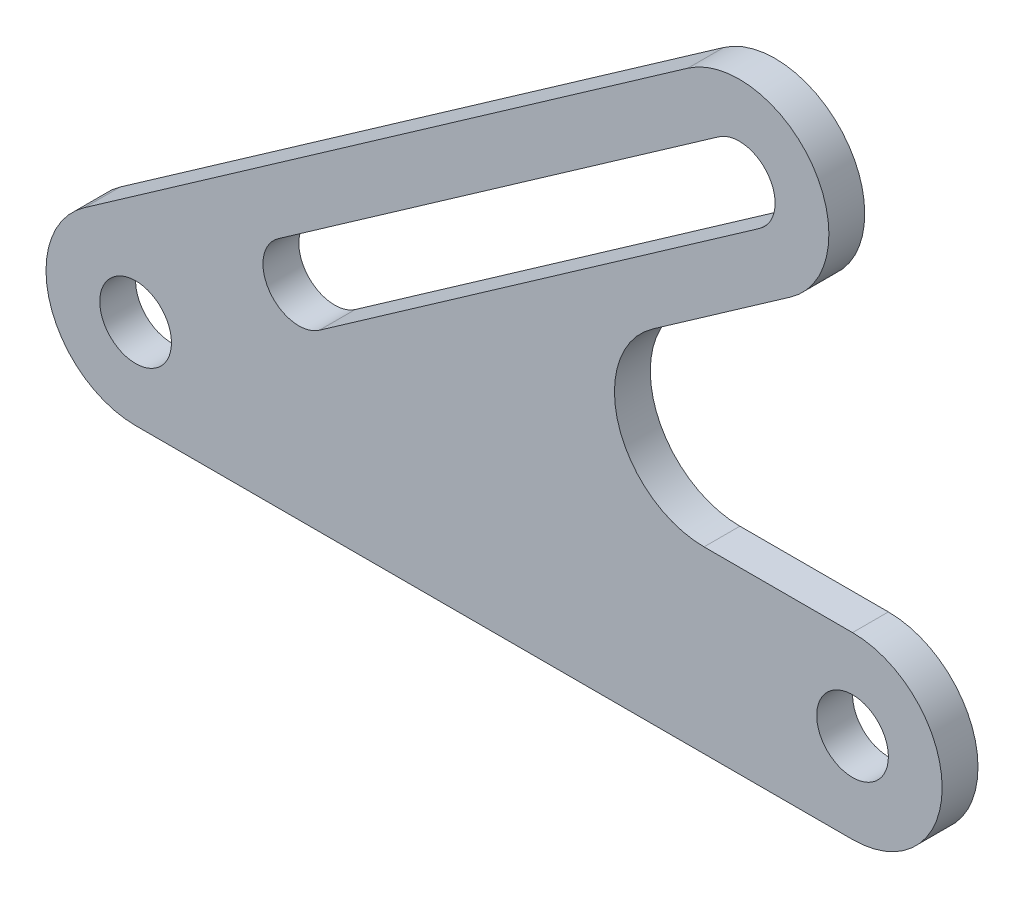
from build123d import *

# Parameters (mm, degrees)
BOSS_EXTRUDE1_DEPTH     = 2
CUT_EXTRUDE1_DEPTH      = 4
CUT_EXTRUDE1_DEPTH_BACK = 107.639946795
SKETCH2_R               = 4
FILLET1_R               = 10


with BuildPart() as part:
    # Sketch1 → Boss-Extrude1 (new, symmetric)
    with BuildSketch(Plane.XY):
        with BuildLine():
            Line((61.625847103, 55.358628577), (-5.735764364, 8.191520443))
            ThreePointArc((-5.735764364, 8.191520443), (-3.007057995, 9.537169507), (0, 10))
            Line((0, 10), (31.715948024, 10))
            Line((31.715948024, 10), (73.09737583, 38.975587692))
            ThreePointArc((73.09737583, 38.975587692), (75.553131909, 52.902872498), (61.625847103, 55.358628577))
        make_face()
        with BuildLine():
            ThreePointArc((0, 10), (-3.007057995, 9.537169507), (-5.735764364, 8.191520443))
            ThreePointArc((-5.735764364, 8.191520443), (-9.537169507, -3.007057995), (0, -10))
            ThreePointArc((0, -10), (3.007057995, -9.537169507), (5.735764364, -8.191520443))
            Line((5.735764364, -8.191520443), (31.715948024, 10))
            Line((31.715948024, 10), (0, 10))
        make_face()
        with BuildLine():
            ThreePointArc((5.735764364, -8.191520443), (3.007057995, -9.537169507), (0, -10))
            Line((0, -10), (80, -10))
            ThreePointArc((80, -10), (90, 0), (80, 10))
            Line((80, 10), (31.715948024, 10))
            Line((31.715948024, 10), (5.735764364, -8.191520443))
        make_face()
    extrude(amount=BOSS_EXTRUDE1_DEPTH, both=True)

    # Sketch2 → Cut-Extrude1 (cut, two sides: drawn at the far end of the back side and taken through both)
    with BuildSketch(Plane.XY.offset(-CUT_EXTRUDE1_DEPTH_BACK)):
        Circle(SKETCH2_R)
        with Locations((80, 0)):
            Circle(SKETCH2_R)
        with BuildLine():
            Line((69.655917211, 43.890499957), (20.506794554, 9.475913776))
            ThreePointArc((20.506794554, 9.475913776), (14.935880632, 10.458216208), (15.918183063, 16.029130131))
            Line((15.918183063, 16.029130131), (65.067305721, 50.443716312))
            ThreePointArc((65.067305721, 50.443716312), (70.638219643, 49.46141388), (69.655917211, 43.890499957))
        make_face()
    extrude(amount=CUT_EXTRUDE1_DEPTH + CUT_EXTRUDE1_DEPTH_BACK, mode=Mode.SUBTRACT)

    # Fillet1
    fillet1_edges = [part.edges().sort_by_distance(p)[0] for p in [
        (31.715948024, 10, 0),
    ]]
    fillet(fillet1_edges, radius=FILLET1_R)


solid = part.part
